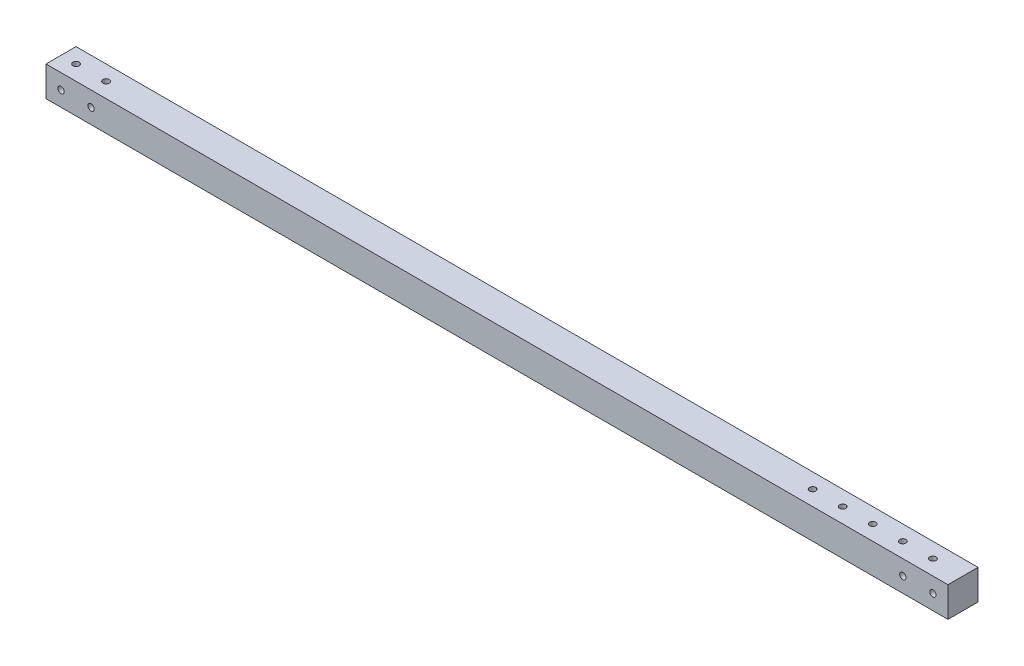
from build123d import *

# Parameters (mm, degrees)
SKETCH_1_W          = 20
SKETCH_1_H          = 20
EXTRUDE_1_DEPTH     = 600
SKETCH_2_R          = 2.1
CUT_EXTRUDE_1_DEPTH = 601.416522091
SKETCH_3_R          = 2.1
CUT_EXTRUDE_2_DEPTH = 601.416522091
SKETCH_4_R          = 2.1
CUT_EXTRUDE_3_DEPTH = 601.416522091


with BuildPart() as part:
    # 草图1 → 凸台-拉伸1 (new body)
    with BuildSketch(Plane(origin=(0, 0, 0), x_dir=(0, 0, -1), z_dir=(1, 0, 0))):
        Rectangle(SKETCH_1_W, SKETCH_1_H)
    extrude(amount=EXTRUDE_1_DEPTH)

    # 草图2 → 切除-拉伸1 (cut, through all)
    with BuildSketch(Plane.XY.offset(10)):
        with Locations((10, 0)):
            Circle(SKETCH_2_R)
        with Locations((30, 0)):
            Circle(SKETCH_2_R)
        with Locations(Location((570, 0, 0), (0, 0, 180))):
            Circle(SKETCH_2_R)
        with Locations(Location((590, 0, 0), (0, 0, 180))):
            Circle(SKETCH_2_R)
    extrude(amount=-CUT_EXTRUDE_1_DEPTH, mode=Mode.SUBTRACT)

    # 草图3 → 切除-拉伸2 (cut, through all)
    with BuildSketch(Plane(origin=(0, 10, 0), x_dir=(1, 0, 0), z_dir=(0, 1, 0))):
        with Locations(Location((10, 0, 0), (0, 0, 270))):
            Circle(SKETCH_3_R)
        with Locations(Location((30, 0, 0), (0, 0, 270))):
            Circle(SKETCH_3_R)
    extrude(amount=-CUT_EXTRUDE_2_DEPTH, mode=Mode.SUBTRACT)

    # 草图4 → 切除-拉伸3 (cut, through all)
    with BuildSketch(Plane(origin=(0, 10, 0), x_dir=(1, 0, 0), z_dir=(0, 1, 0))):
        with Locations(Location((580, 0, 0), (0, 0, 270))):
            Circle(SKETCH_4_R)
        with Locations(Location((560, 0, 0), (0, 0, 270))):
            Circle(SKETCH_4_R)
        with Locations(Location((540, 0, 0), (0, 0, 270))):
            Circle(SKETCH_4_R)
        with Locations(Location((520, 0, 0), (0, 0, 270))):
            Circle(SKETCH_4_R)
        with Locations(Location((500, 0, 0), (0, 0, 270))):
            Circle(SKETCH_4_R)
    extrude(amount=-CUT_EXTRUDE_3_DEPTH, mode=Mode.SUBTRACT)


solid = part.part
